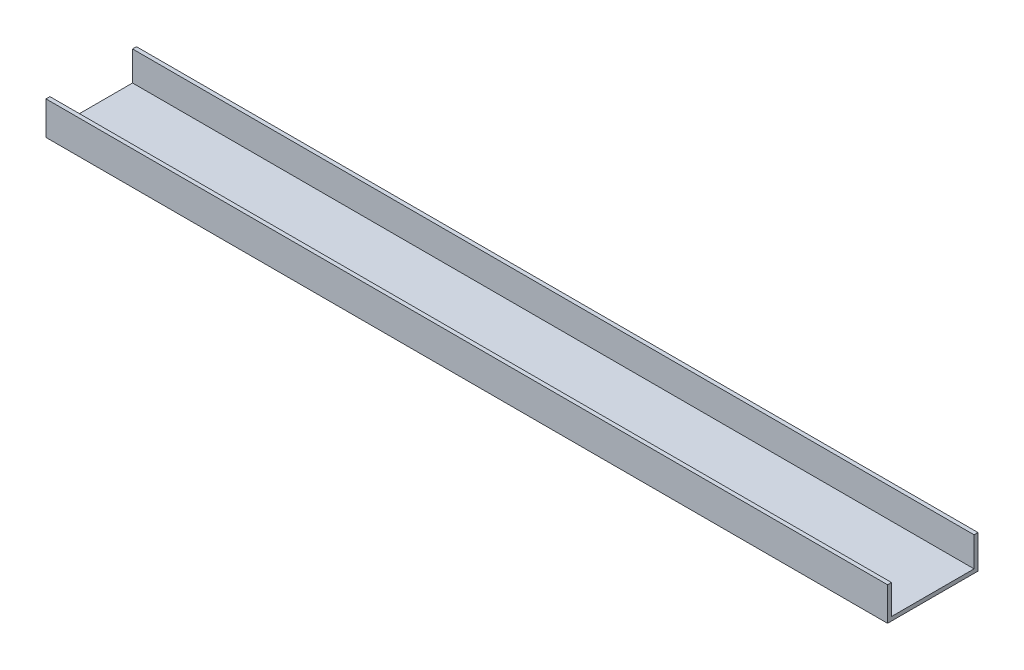
from build123d import *

# Parameters (mm, degrees)
BOSS_EXTRUDE1_DEPTH = 214


with BuildPart() as part:
    # Sketch2 → Boss-Extrude1 (new body)
    with BuildSketch(Plane(origin=(0, 0, 0), x_dir=(0, 0, -1), z_dir=(1, 0, 0))):
        Polygon((-4, 4.25), (-4, -3.25), (17, -3.25), (17, 4.25), (18, 4.25), (18, -4.25), (-5, -4.25), (-5, 4.25), align=None)
    extrude(amount=BOSS_EXTRUDE1_DEPTH)


solid = part.part
